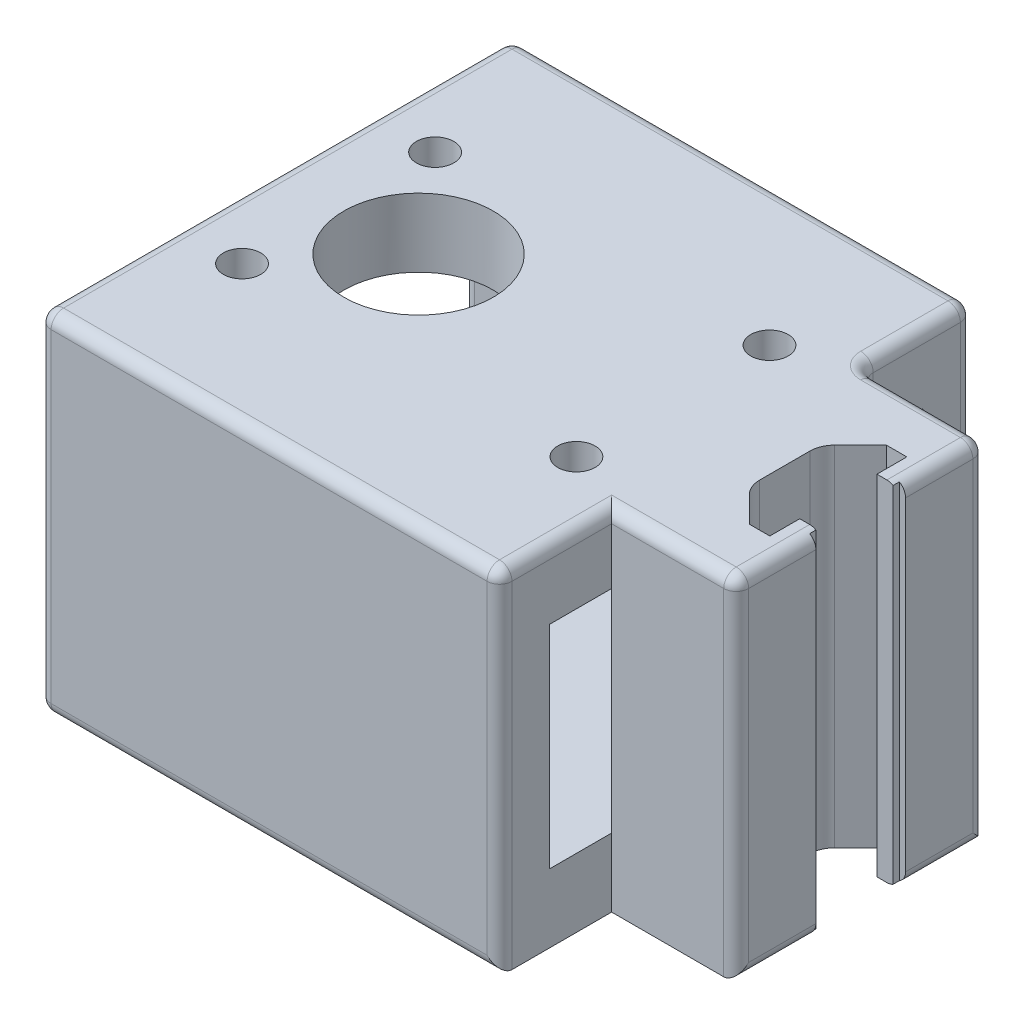
from build123d import *

# Parameters (mm, degrees)
SKETCH2_W           = 30
SKETCH2_H           = 17
BOSS_EXTRUDE1_DEPTH = 37
SKETCH3_R           = 6
CUT_EXTRUDE1_DEPTH  = 5.5
CUT_EXTRUDE3_REACH  = 54.479
SKETCH4_R           = 1.5
BOSS_EXTRUDE2_REACH = 52.14
FILLET1_R           = 1


with BuildPart() as part:
    # Sketch2 → Boss-Extrude1 (new body)
    with BuildSketch(Plane(origin=(0, 0, 0), x_dir=(0, 0, -1), z_dir=(1, 0, 0))):
        Polygon((19, -14), (3.999996995, -14), (0, -17.999996995), (-3.999996995, -14), (-19, -14), (-19, 14), (19, 14), align=None)
        Rectangle(SKETCH2_W, SKETCH2_H, mode=Mode.SUBTRACT)
    extrude(amount=BOSS_EXTRUDE1_DEPTH)

    # Sketch3 → Cut-Extrude1 (cut)
    with BuildSketch(Plane(origin=(0, 14, 0), x_dir=(1, 0, 0), z_dir=(0, 1, 0))):
        with Locations(Location((11.5, 0, 0), (0, 0, 270))):
            Circle(SKETCH3_R)
    extrude(amount=-CUT_EXTRUDE1_DEPTH, mode=Mode.SUBTRACT)

    # Sketch4 → Cut-Extrude3 (cut, up to next)
    with BuildSketch(Plane(origin=(0, 14, 0), x_dir=(1, 0, 0), z_dir=(0, 1, 0)), mode=Mode.PRIVATE) as cut_extrude3_sk1:
        with Locations(Location((5.076606241, 7.75, 0), (0, 0, 270))):
            Circle(SKETCH4_R)
    cut_extrude3_tool1 = extrude(cut_extrude3_sk1.sketch, amount=-CUT_EXTRUDE3_REACH, mode=Mode.PRIVATE) & part.part
    # Sketch4 → Cut-Extrude3 (cut, up to next)
    with BuildSketch(Plane(origin=(0, 14, 0), x_dir=(1, 0, 0), z_dir=(0, 1, 0)), mode=Mode.PRIVATE) as cut_extrude3_sk2:
        with Locations(Location((31.923393759, 7.75, 0), (0, 0, 270))):
            Circle(SKETCH4_R)
    cut_extrude3_tool2 = extrude(cut_extrude3_sk2.sketch, amount=-CUT_EXTRUDE3_REACH, mode=Mode.PRIVATE) & part.part
    # Sketch4 → Cut-Extrude3 (cut, up to next)
    with BuildSketch(Plane(origin=(0, 14, 0), x_dir=(1, 0, 0), z_dir=(0, 1, 0)), mode=Mode.PRIVATE) as cut_extrude3_sk3:
        with Locations(Location((31.923393759, -7.75, 0), (0, 0, 270))):
            Circle(SKETCH4_R)
    cut_extrude3_tool3 = extrude(cut_extrude3_sk3.sketch, amount=-CUT_EXTRUDE3_REACH, mode=Mode.PRIVATE) & part.part
    # Sketch4 → Cut-Extrude3 (cut, up to next)
    with BuildSketch(Plane(origin=(0, 14, 0), x_dir=(1, 0, 0), z_dir=(0, 1, 0)), mode=Mode.PRIVATE) as cut_extrude3_sk4:
        with Locations(Location((5.076606241, -7.75, 0), (0, 0, 270))):
            Circle(SKETCH4_R)
    cut_extrude3_tool4 = extrude(cut_extrude3_sk4.sketch, amount=-CUT_EXTRUDE3_REACH, mode=Mode.PRIVATE) & part.part
    add(cut_extrude3_tool1.solids().sort_by_distance((5.076606, 14, -7.75))[0], mode=Mode.SUBTRACT)
    add(cut_extrude3_tool2.solids().sort_by_distance((31.923394, 14, -7.75))[0], mode=Mode.SUBTRACT)
    add(cut_extrude3_tool3.solids().sort_by_distance((31.923394, 14, 7.75))[0], mode=Mode.SUBTRACT)
    add(cut_extrude3_tool4.solids().sort_by_distance((5.076606, 14, 7.75))[0], mode=Mode.SUBTRACT)

    # Boss-Extrude2: up to this face of the body (flat: up to its plane)
    boss_extrude2_end = Plane(part.part.faces().sort_by_distance((19.126018989, 14, 0))[0])
    # Sketch6 → Boss-Extrude2 (add, up to the picked face)
    with BuildSketch(Plane(origin=(0, -14, 0), x_dir=(1, 0, 0), z_dir=(0, 1, 0)), mode=Mode.PRIVATE) as boss_extrude2_sk1:
        with BuildLine():
            Line((47, 3.6), (46.5, 3.6))
            Line((46.5, 3.6), (46.5, 3.1))
            Line((46.5, 3.1), (45.2, 3.1))
            Line((45.2, 3.1), (45.2, 5.5))
            Line((45.2, 5.5), (43.560660172, 5.5))
            Line((43.560660172, 5.5), (41.485786438, 3.425126266))
            ThreePointArc((41.485786438, 3.425126266), (41.052240935, 2.776279568), (40.9, 2.010912703))
            Line((40.9, 2.010912703), (40.9, -2.010912703))
            ThreePointArc((40.9, -2.010912703), (41.052240935, -2.776279568), (41.485786438, -3.425126266))
            Line((41.485786438, -3.425126266), (43.560660172, -5.5))
            Line((43.560660172, -5.5), (45.2, -5.5))
            Line((45.2, -5.5), (45.2, -3.1))
            Line((45.2, -3.1), (46.5, -3.1))
            Line((46.5, -3.1), (46.5, -3.6))
            Line((46.5, -3.6), (47, -3.6))
            Line((47, -3.6), (47, -10))
            Line((47, -10), (37, -10))
            Line((37, -10), (37, 10))
            Line((37, 10), (47, 10))
            Line((47, 10), (47, 3.6))
        make_face()
    boss_extrude2_tool1 = split(extrude(boss_extrude2_sk1.sketch, amount=BOSS_EXTRUDE2_REACH, mode=Mode.PRIVATE), bisect_by=boss_extrude2_end, keep=Keep.BOTH, mode=Mode.PRIVATE)
    add(boss_extrude2_tool1.solids().sort_by(Axis((46.75, -14, -3.823607), (0, 1, 0)))[0])

    # Fillet1
    fillet1_edges = [part.edges().sort_by_distance(p)[0] for p in [
        (42, 14, -10),
        (0, -8.5, 0),
        (0, 0, 15),
        (0, 8.5, 0),
        (0, 0, -15),
        (0, -14, 11.499998498),
        (0, -15.999998498, 1.999998498),
        (0, -15.999998498, -1.999998498),
        (0, -14, -11.499998498),
        (0, 14, 0),
        (18.5, -14, -19),
        (37, 0, -19),
        (18.5, 14, -19),
        (0, 0, -19),
        (18.5, 14, 19),
        (37, 0, 19),
        (18.5, -14, 19),
        (0, 0, 19),
        (37, 14, -14.5),
        (37, 11.25, -10),
        (42, 14, 10),
        (37, 14, 14.5),
        (47, 0, -10),
        (47, 0, 10),
        (47, 14, 6.8),
        (47, -14, 6.8),
        (47, 14, -6.8),
        (47, -14, -6.8),
    ]]
    fillet(fillet1_edges, radius=FILLET1_R)


solid = part.part
